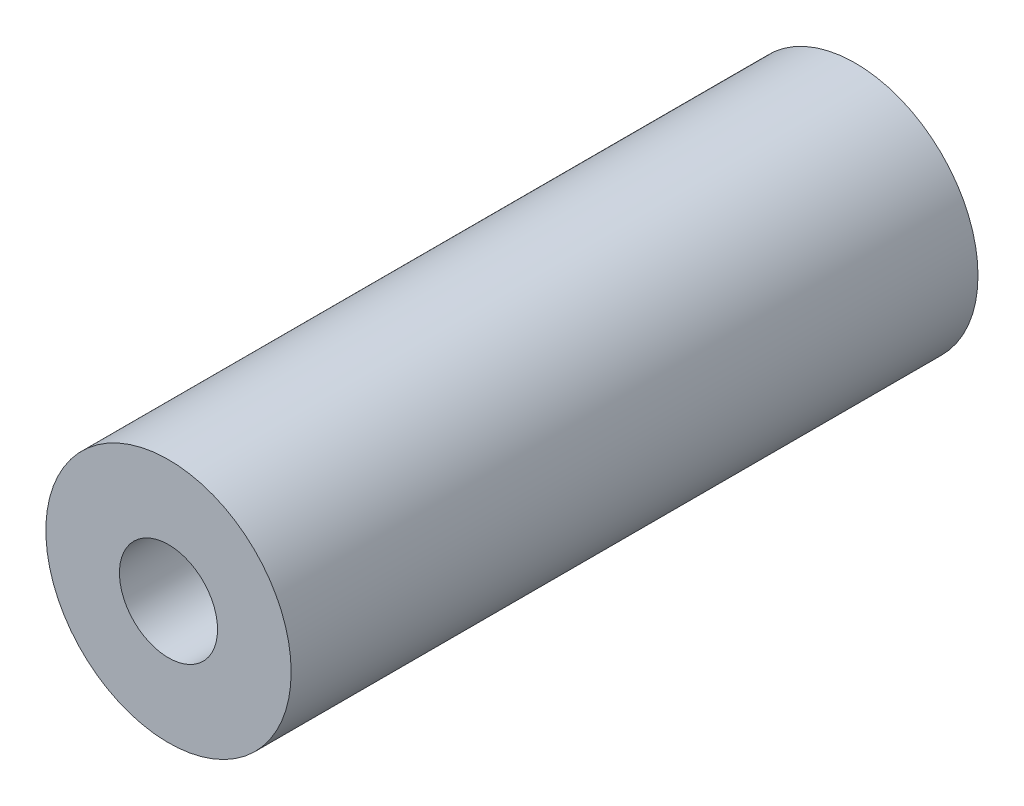
from build123d import *

# Parameters (mm, degrees)
SKETCH1_R           = 2.5
SKETCH1_R_2         = 1
BOSS_EXTRUDE1_DEPTH = 14


with BuildPart() as part:
    # Sketch1 → Boss-Extrude1 (new body)
    with BuildSketch(Plane.XY):
        with Locations((24, 0)):
            Circle(SKETCH1_R)
        with Locations((24, 0)):
            Circle(SKETCH1_R_2, mode=Mode.SUBTRACT)
    extrude(amount=BOSS_EXTRUDE1_DEPTH)


solid = part.part
